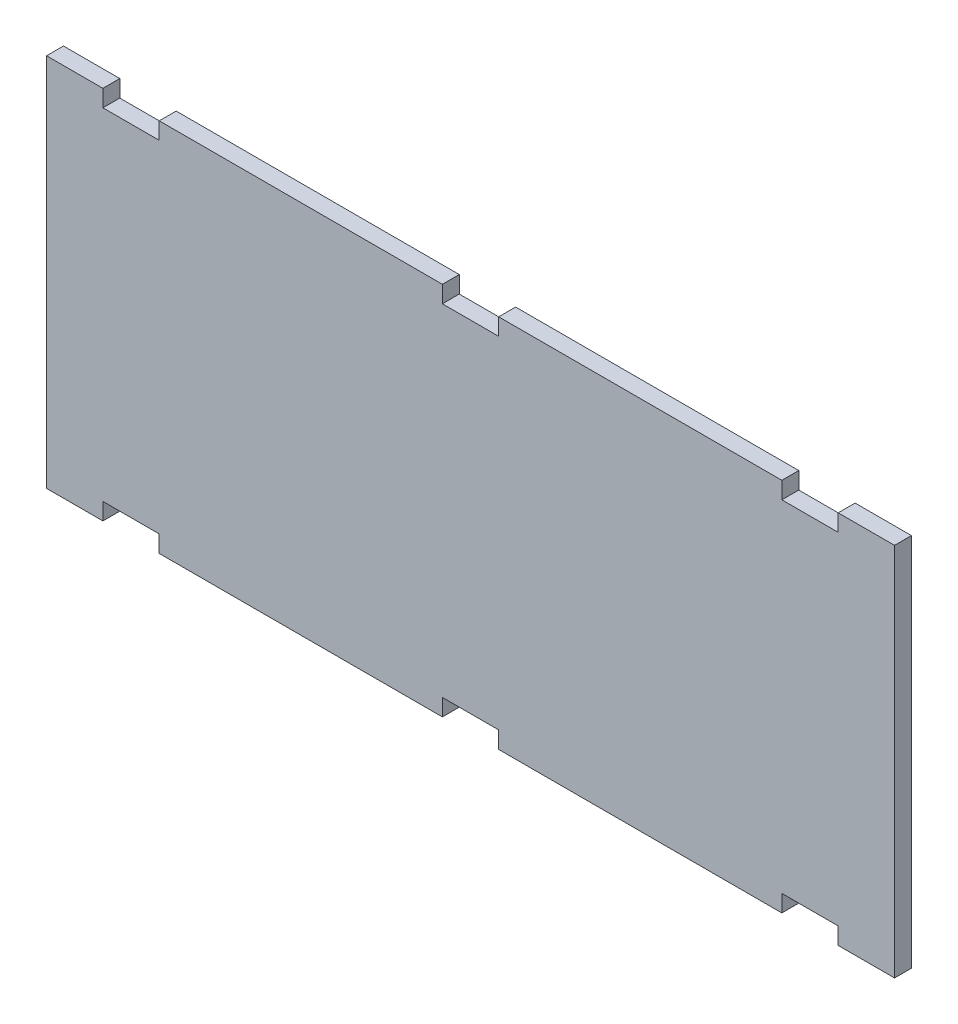
from build123d import *

# Parameters (mm, degrees)
BOSS_EXTRU_1_DEPTH = 6


with BuildPart() as part:
    # Esquisse1 → Boss.-Extru.1 (new body)
    with BuildSketch(Plane.XY):
        Polygon((-20, 0), (-20, 6), (-40, 6), (-40, 0), (-140.5, 0), (-140.5, 6), (-160.5, 6), (-160.5, 0), (-261, 0), (-261, 6), (-281, 6), (-281, 0), (-301, 0), (-301, 133), (-281, 133), (-281, 127), (-261, 127), (-261, 133), (-160.5, 133), (-160.5, 127), (-140.5, 127), (-140.5, 133), (-40, 133), (-40, 127), (-20, 127), (-20, 133), (0, 133), (0, 0), align=None)
    extrude(amount=BOSS_EXTRU_1_DEPTH)


solid = part.part
